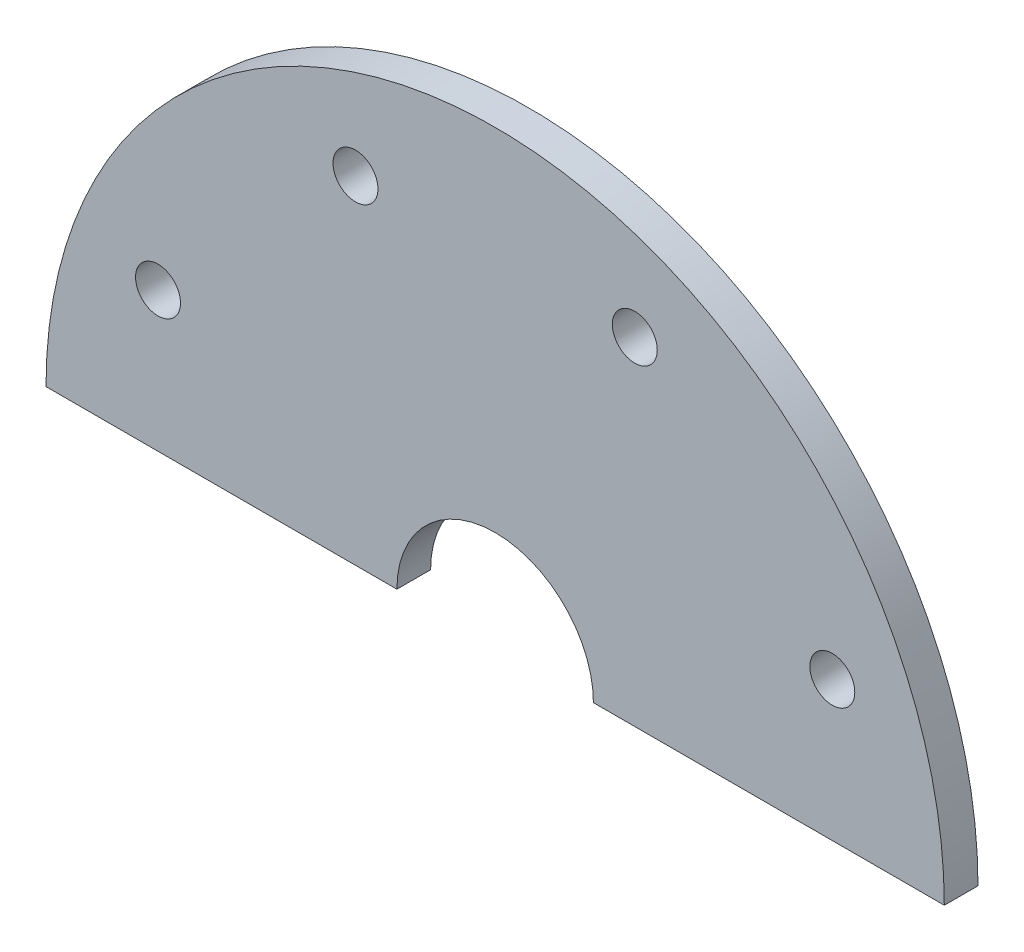
from build123d import *

# Parameters (mm, degrees)
SKETCH1_R           = 4
BOSS_EXTRUDE1_DEPTH = 6


with BuildPart() as part:
    # Sketch1 → Boss-Extrude1 (new body)
    with BuildSketch(Plane.XY):
        with BuildLine():
            Line((-80, 0), (-17.5, 0))
            ThreePointArc((-17.5, 0), (0, 17.5), (17.5, 0))
            Line((17.5, 0), (80, 0))
            ThreePointArc((80, 0), (0, 80), (-80, 0))
        make_face()
        with Locations((24.874423104, 60.052169613)):
            Circle(SKETCH1_R, mode=Mode.SUBTRACT)
        with Locations((60.052169613, 24.874423104)):
            Circle(SKETCH1_R, mode=Mode.SUBTRACT)
        with Locations((-60.052169613, 24.874423104)):
            Circle(SKETCH1_R, mode=Mode.SUBTRACT)
        with Locations(Location((-24.874423104, 60.052169613, 0), (0, 0, 180))):
            Circle(SKETCH1_R, mode=Mode.SUBTRACT)
    extrude(amount=BOSS_EXTRUDE1_DEPTH)


solid = part.part
